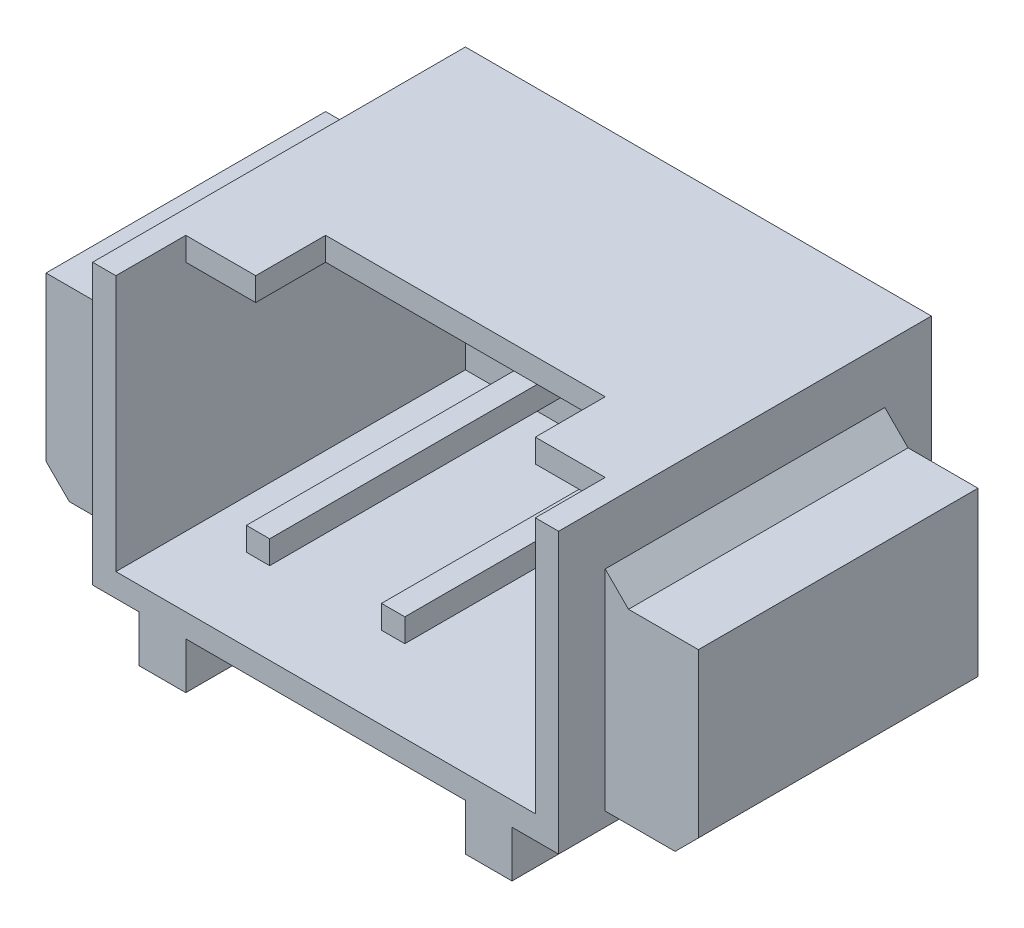
from build123d import *

# Parameters (mm, degrees)
BOSS_EXTRUDE1_DEPTH = 2
SKETCH1_3_W         = 1
SKETCH1_3_H         = 2
BOSS_EXTRUDE2_DEPTH = 1.5
CHAMFER1_SIZE       = 0.25
SKETCH2_W           = 2.25
SKETCH2_H           = 2.5
SKETCH2_W_2         = 0.25
SKETCH2_H_2         = 0.25
CUT_EXTRUDE1_DEPTH  = 3.75
CUT_EXTRUDE2_REACH  = 7.339
SKETCH3_W           = 0.75
SKETCH3_H           = 0.75


with BuildPart() as part:
    # Sketch1 → Boss-Extrude1 (new, symmetric)
    with BuildSketch(Plane.XY):
        Polygon((-1.5, 0), (0, 0), (0, 3), (-2.5, 3), (-2.5, 0), (-2, 0), (-2, -0.5), (-1.5, -0.5), align=None)
    extrude(amount=BOSS_EXTRUDE1_DEPTH, both=True)

    # Sketch1<3> → Boss-Extrude2 (add, symmetric)
    with BuildSketch(Plane.XY):
        with Locations((-3, 1.15)):
            Rectangle(SKETCH1_3_W, SKETCH1_3_H)
    extrude(amount=BOSS_EXTRUDE2_DEPTH, both=True)

    # Chamfer1
    chamfer1_edges = [part.edges().sort_by_distance(p)[0] for p in [
        (-3.5, 0.15, 0),
        (-2.5, 2.15, 0),
    ]]
    chamfer(chamfer1_edges, length=CHAMFER1_SIZE)

    # Sketch2 → Cut-Extrude1 (cut)
    with BuildSketch(Plane.XY.offset(2)):
        with Locations((-1.125, 1.5)):
            Rectangle(SKETCH2_W, SKETCH2_H)
        with Locations((-0.725, 1.255)):
            Rectangle(SKETCH2_W_2, SKETCH2_H_2, mode=Mode.SUBTRACT)
    extrude(amount=-CUT_EXTRUDE1_DEPTH, mode=Mode.SUBTRACT)

    # Sketch3 → Cut-Extrude2 (cut, up to next)
    with BuildSketch(Plane(origin=(0, 3, 0), x_dir=(1, 0, 0), z_dir=(0, 1, 0)), mode=Mode.PRIVATE) as cut_extrude2_sk1:
        Polygon((-1.5, -2), (0, -2), (0, -0.5), (-1.5, -0.5), (-1.5, -1.25), align=None)
    cut_extrude2_tool1 = extrude(cut_extrude2_sk1.sketch, amount=-CUT_EXTRUDE2_REACH, mode=Mode.PRIVATE) & part.part
    # Sketch3 → Cut-Extrude2 (cut, up to next)
    with BuildSketch(Plane(origin=(0, 3, 0), x_dir=(1, 0, 0), z_dir=(0, 1, 0)), mode=Mode.PRIVATE) as cut_extrude2_sk2:
        with Locations((-1.875, -1.625)):
            Rectangle(SKETCH3_W, SKETCH3_H)
    cut_extrude2_tool2 = extrude(cut_extrude2_sk2.sketch, amount=-CUT_EXTRUDE2_REACH, mode=Mode.PRIVATE) & part.part
    add(cut_extrude2_tool1.solids().sort_by_distance((-0.75, 3, 1.25))[0], mode=Mode.SUBTRACT)
    add(cut_extrude2_tool2.solids().sort_by_distance((-1.875, 3, 1.625))[0], mode=Mode.SUBTRACT)

    # Mirror1: part across plane


with BuildPart() as part_1:
    add(part.part)
    add(part.part.mirror(Plane(origin=(0, 0, 2), x_dir=(0, 0, 1), z_dir=(-1, 0, 0))))


solid = part_1.part
